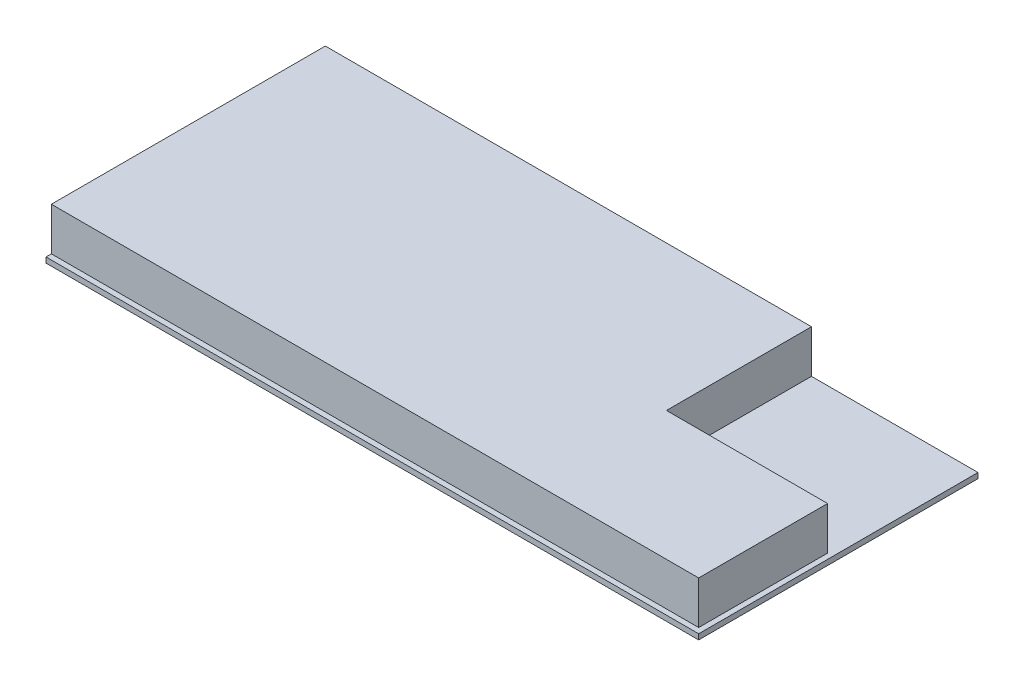
from build123d import *

# Parameters (mm, degrees)
SKETCH_1_W          = 6075
SKETCH_1_H          = 2600
EXTRUDE_1_DEPTH     = 50
EXTRUDE_2_DEPTH     = 400
SKETCH_3_W          = 6075
SKETCH_3_H          = 2600
CUT_EXTRUDE_1_DEPTH = 6229.814092586


with BuildPart() as part:
    # 草图1 → 凸台-拉伸1 (new body)
    with BuildSketch(Plane(origin=(0, 0, 0), x_dir=(1, 0, 0), z_dir=(0, 1, 0))):
        with Locations((-3037.5, 0)):
            Rectangle(SKETCH_1_W, SKETCH_1_H)
    extrude(amount=EXTRUDE_1_DEPTH)

    # 草图2 → 凸台-拉伸2 (add)
    with BuildSketch(Plane(origin=(0, 50, 0), x_dir=(1, 0, 0), z_dir=(0, 1, 0))):
        Polygon((0, 1300), (0, -1250), (-6025, -1250), (-6025, -50), (-4525, -50), (-4525, 1300), align=None)
    extrude(amount=EXTRUDE_2_DEPTH)

    # 镜向1: part across plane


with BuildPart() as part_1:
    add(part.part)
    add(part.part.mirror(Plane(origin=(0, 50, 1300), x_dir=(0, 0, 1), z_dir=(-1, 0, 0))))

    # 草图3 → 切除-拉伸1 (cut, through all)
    with BuildSketch(Plane(origin=(0, 450, 0), x_dir=(1, 0, 0), z_dir=(0, 1, 0))):
        with Locations((-3037.5, 0)):
            Rectangle(SKETCH_3_W, SKETCH_3_H)
    extrude(amount=-CUT_EXTRUDE_1_DEPTH, mode=Mode.SUBTRACT)


solid = part_1.part
